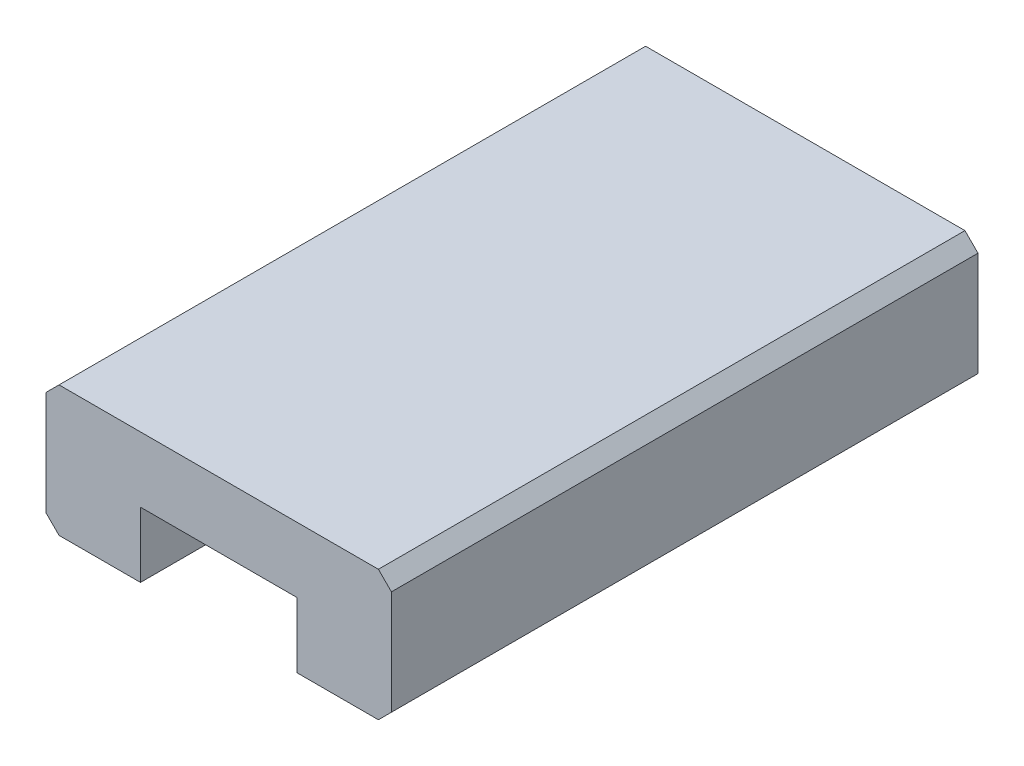
from build123d import *

# Parameters (mm, degrees)
BOSS_EXTRUDE1_DEPTH = 45
CHAMFER1_SIZE       = 1


with BuildPart() as part:
    # Sketch1 → Boss-Extrude1 (new body)
    with BuildSketch(Plane.XY):
        Polygon((6, -5), (13.25, -5), (13.25, 5), (-13.25, 5), (-13.25, -5), (-6, -5), (-6, 0), (6, 0), align=None)
    extrude(amount=-BOSS_EXTRUDE1_DEPTH)

    # Chamfer1
    chamfer1_edges = [part.edges().sort_by_distance(p)[0] for p in [
        (-13.25, -5, -22.5),
        (-13.25, 5, -22.5),
        (13.25, 5, -22.5),
        (13.25, -5, -22.5),
    ]]
    chamfer(chamfer1_edges, length=CHAMFER1_SIZE)


solid = part.part
